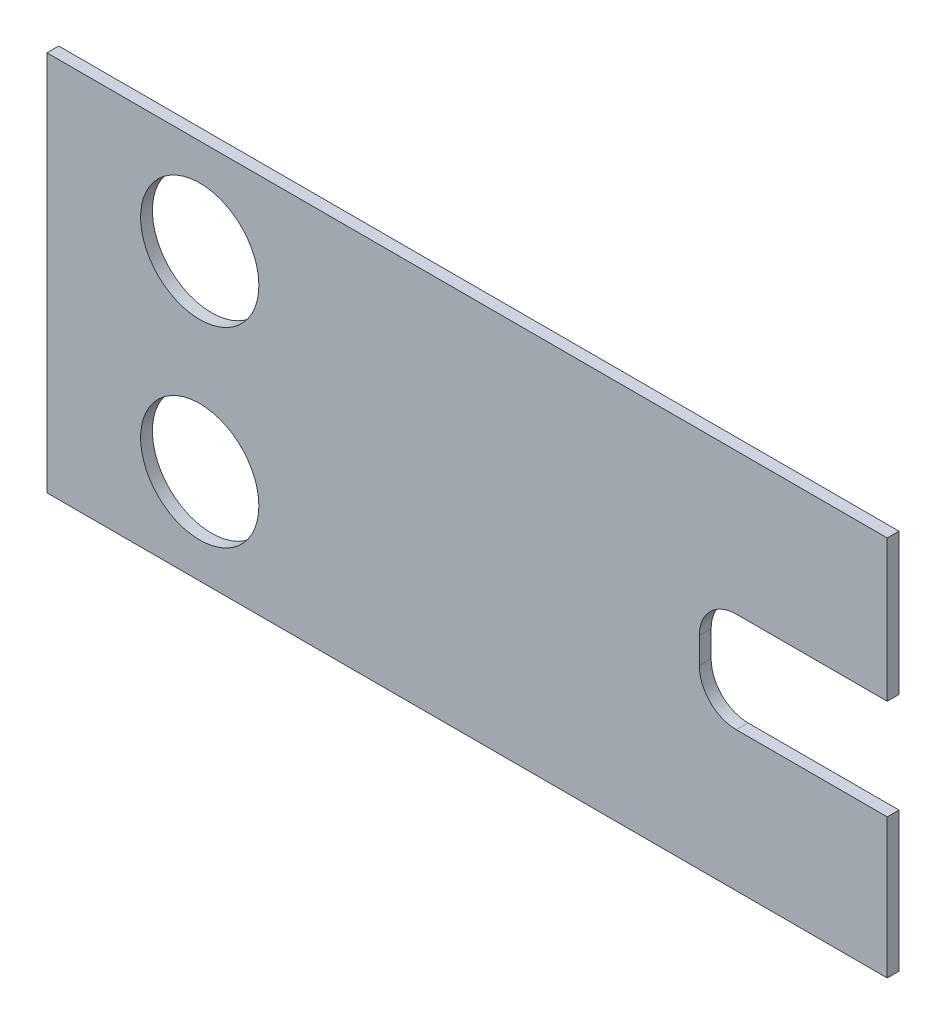
from build123d import *

# Parameters (mm, degrees)
SKETCH1_W             = 34.925
SKETCH1_H             = 15.84
BOSS_EXTRUDE1_DEPTH   = 0.245
CUT_EXTRUDE1_DEPTH    = 39.352331415
F_8_CLEARANCE_HOLE1_D = 4.9149


with BuildPart() as part:
    # Sketch1 → Boss-Extrude1 (new, symmetric)
    with BuildSketch(Plane.XY):
        with Locations((17.4625, -7.92)):
            Rectangle(SKETCH1_W, SKETCH1_H)
    extrude(amount=BOSS_EXTRUDE1_DEPTH, both=True)

    # Sketch2 → Cut-Extrude1 (cut, through all)
    with BuildSketch(Plane.XY.offset(0.245)):
        with BuildLine():
            Line((34.925, -5.88), (28.649421715, -5.88))
            ThreePointArc((28.649421715, -5.88), (27.564421715, -6.329421715), (27.115, -7.414421715))
            Line((27.115, -7.414421715), (27.115, -8.505578285))
            ThreePointArc((27.115, -8.505578285), (27.564421715, -9.590578285), (28.649421715, -10.04))
            Line((28.649421715, -10.04), (34.925, -10.04))
            Line((34.925, -10.04), (34.925, -5.88))
        make_face()
    extrude(amount=-CUT_EXTRUDE1_DEPTH, mode=Mode.SUBTRACT)

    # #8 Clearance Hole1 (through all)
    with Locations(Plane.XY.offset(0.245)):
        with Locations((6.35, -3.96875), (6.35, -11.90625)):
            Hole(F_8_CLEARANCE_HOLE1_D / 2)


solid = part.part
